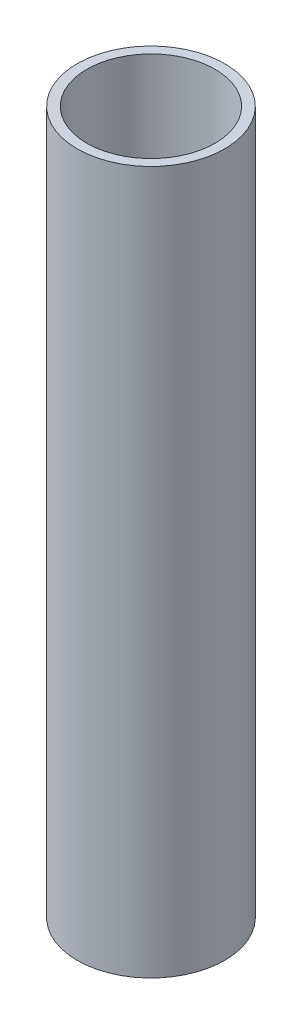
from build123d import *

# Parameters (mm, degrees)
SKETCH1_R           = 16.8
SKETCH1_R_2         = 14.6
BOSS_EXTRUDE1_DEPTH = 160


with BuildPart() as part:
    # Sketch1 → Boss-Extrude1 (new body)
    with BuildSketch(Plane(origin=(0, 0, 0), x_dir=(1, 0, 0), z_dir=(0, 1, 0))):
        with Locations(Location((0, 0, 0), (0, 0, 270))):
            Circle(SKETCH1_R)
        with Locations(Location((0, 0, 0), (0, 0, 270))):
            Circle(SKETCH1_R_2, mode=Mode.SUBTRACT)
    extrude(amount=BOSS_EXTRUDE1_DEPTH)


solid = part.part
